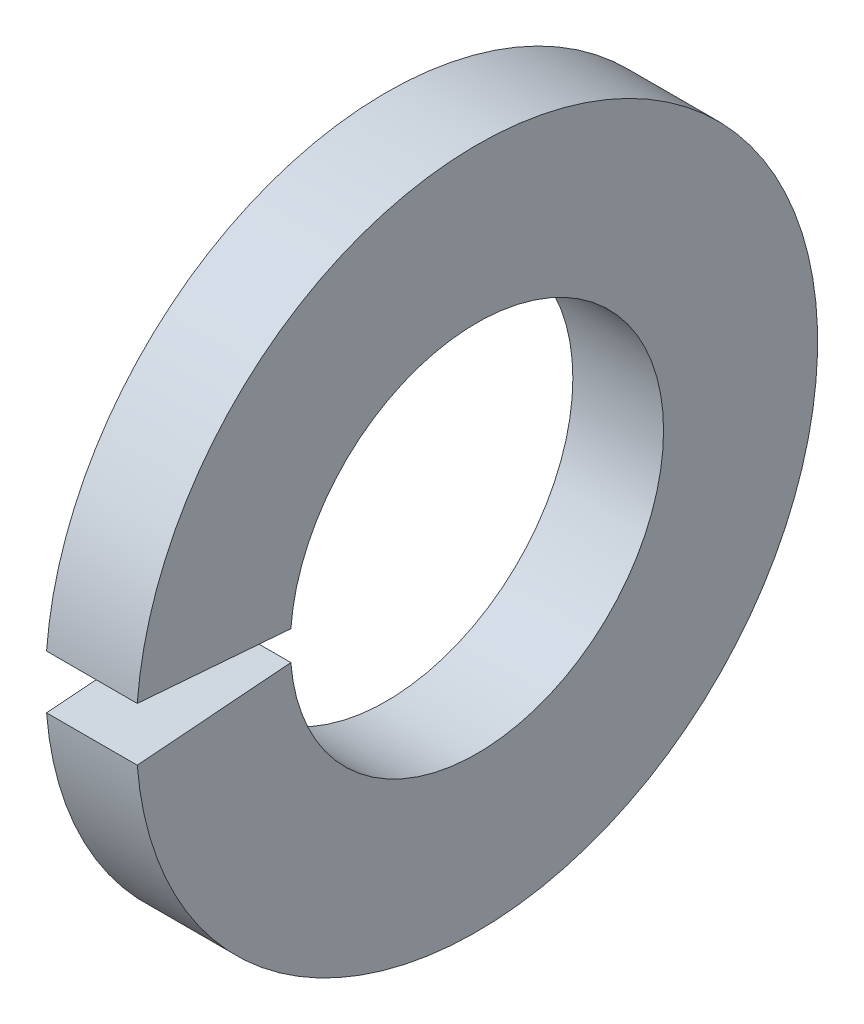
from build123d import *

# Parameters (mm, degrees)
SKETCH1_W = 1.9812
SKETCH1_H = 3.3655
GAP_DEPTH = 11.709707518


with BuildPart() as part:
    # Sketch1 → Base-Revolve (revolve)
    with BuildSketch(Plane.XY, mode=Mode.PRIVATE) as base_revolve_sk:
        with Locations((-0.9906, 5.75945)):
            Rectangle(SKETCH1_W, SKETCH1_H)
    revolve(base_revolve_sk.sketch.rotate(Axis((-34.925, 0, 0), (1, 0, 0)), 90), axis=Axis((-34.925, 0, 0), (1, 0, 0)))

    # Sketch2 → Gap (cut, through all)
    with BuildSketch(Plane(origin=(0, 0, 0), x_dir=(0, -1, 0), z_dir=(-1, 0, 0))):
        with BuildLine():
            Line((0, 0), (0.595586448, 7.567643345))
            ThreePointArc((0.595586448, 7.567643345), (0, 7.591044), (-0.595586448, 7.567643345))
            Line((-0.595586448, 7.567643345), (0, 0))
        make_face()
    extrude(amount=GAP_DEPTH, mode=Mode.SUBTRACT)


solid = part.part
